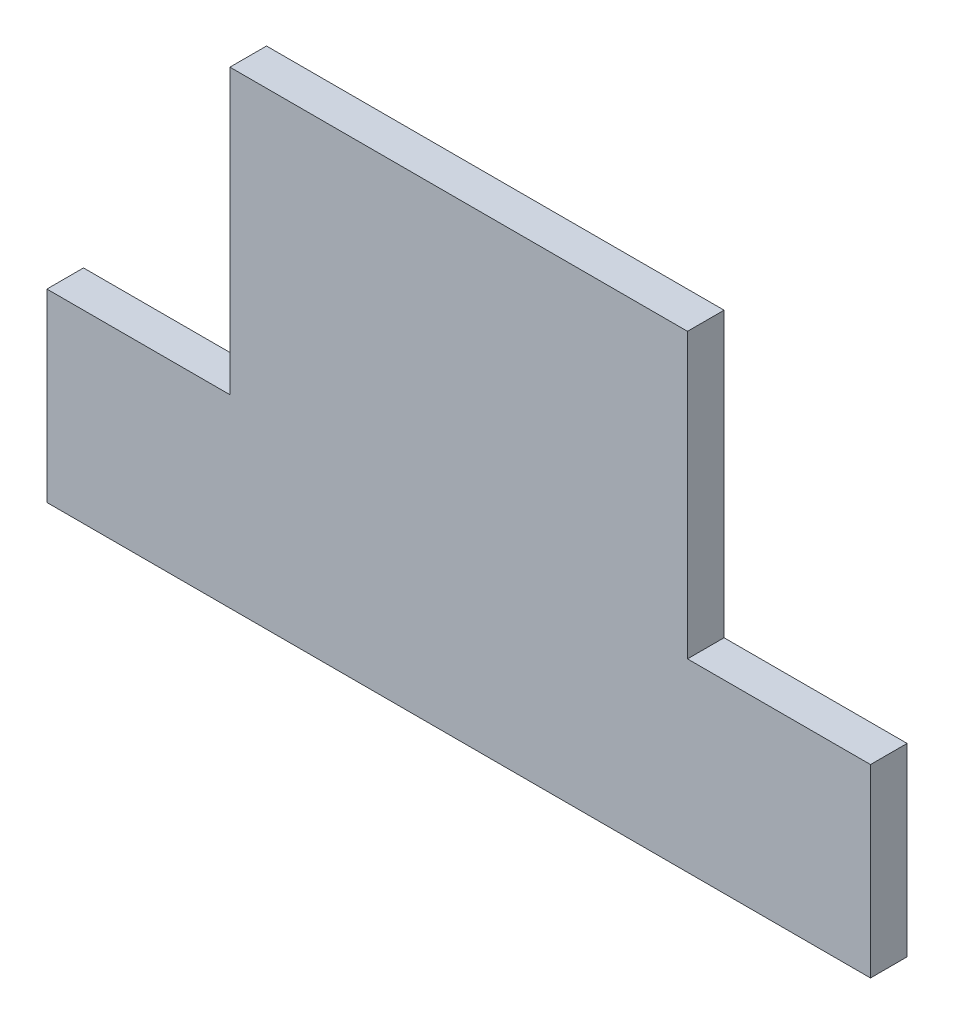
from build123d import *

# Parameters (mm, degrees)
SKETCH1_W           = 45
SKETCH1_H           = 10.1
SKETCH1_W_2         = 25
SKETCH1_H_2         = 15.5
BOSS_EXTRUDE1_DEPTH = 2


with BuildPart() as part:
    # Sketch1 → Boss-Extrude1 (new body)
    with BuildSketch(Plane.XY):
        with Locations((1.014889157, -11.65)):
            Rectangle(SKETCH1_W, SKETCH1_H)
        with Locations((1.014889157, 1.15)):
            Rectangle(SKETCH1_W_2, SKETCH1_H_2)
    extrude(amount=BOSS_EXTRUDE1_DEPTH)


solid = part.part
